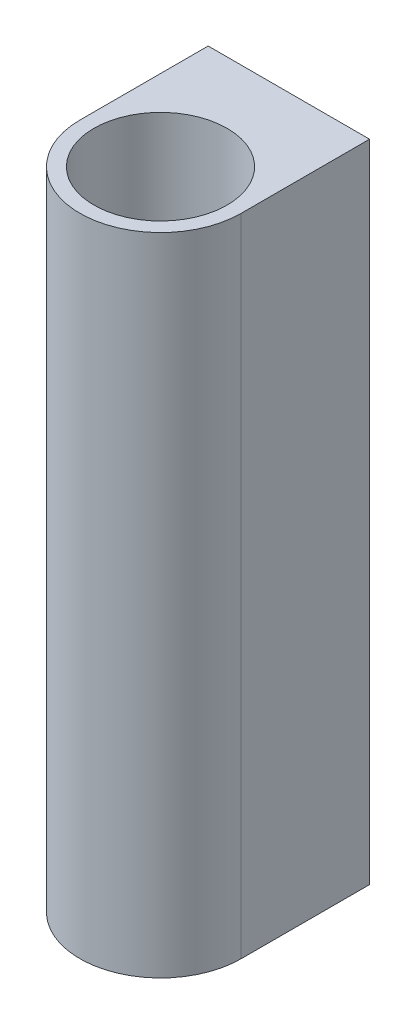
from build123d import *

# Parameters (mm, degrees)
BOSS_EXTRUDE1_START = -203.2
BOSS_EXTRUDE1_DEPTH = 203.2
SKETCH15_R          = 5
CUT_EXTRUDE1_DEPTH  = 15


with BuildPart() as part:
    # Sketch12 → Revolve1 (revolve)
    with BuildSketch(Plane.XY, mode=Mode.PRIVATE) as revolve1_sk:
        Polygon((-25.399999994, 0), (-25.399999994, 203.2), (-20.955, 203.2), (-20.955, 165.1), (-19.177, 165.1), (-19.177, 38.1), (-20.955, 38.1), (-20.955, 0), align=None)
    revolve(revolve1_sk.sketch.rotate(Axis((0, 0, 0), (0, 1, 0)), 270), axis=Axis((0, 0, 0), (0, 1, 0)))

    # Sketch13 → Boss-Extrude1 (add)
    with BuildSketch(Plane(origin=(0, 0, 0), x_dir=(-1, 0, 0), z_dir=(0, -1, 0)).offset(BOSS_EXTRUDE1_START)):
        with BuildLine():
            Line((12.584838028, 40.399999994), (-25.399999994, 40.399999994))
            Line((-25.399999994, 40.399999994), (-25.399999994, 0))
            ThreePointArc((-25.399999994, 0), (0, 25.399999994), (25.399999994, 0))
            Line((25.399999994, 0), (25.399999994, 40.399999994))
            Line((25.399999994, 40.399999994), (22.584838028, 40.399999994))
            Line((22.584838028, 40.399999994), (12.584838028, 40.399999994))
        make_face()
    extrude(amount=BOSS_EXTRUDE1_DEPTH)

    # Sketch15 → Cut-Extrude1 (cut)
    with BuildSketch(Plane(origin=(0, 0, -40.399999994), x_dir=(-1, 0, 0), z_dir=(0, 0, -1))):
        with Locations((-12.699999997, 30)):
            Circle(SKETCH15_R)
        with Locations((-12.699999997, 173.2)):
            Circle(SKETCH15_R)
    cut_extrude1 = extrude(amount=-CUT_EXTRUDE1_DEPTH, mode=Mode.SUBTRACT)

    # Mirror1: Cut-Extrude1 across plane
    add(cut_extrude1.mirror(Plane(origin=(0, 0, 0), x_dir=(0, 0, 1), z_dir=(1, 0, 0))), mode=Mode.SUBTRACT)


solid = part.part
